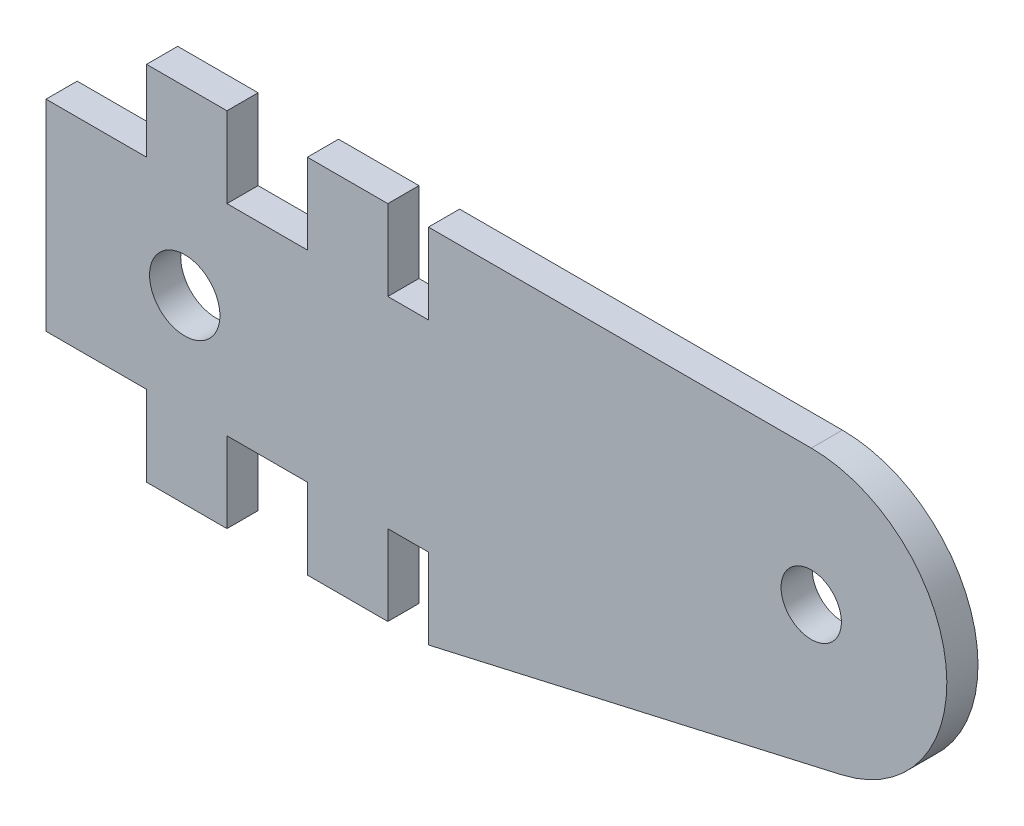
from build123d import *

# Parameters (mm, degrees)
SKETCH1_R           = 1.75
SKETCH1_R_2         = 1.5
BOSS_EXTRUDE1_DEPTH = 1.55


with BuildPart() as part:
    # Sketch1 → Boss-Extrude1 (new body)
    with BuildSketch(Plane.XY):
        with BuildLine():
            Line((5, 0), (9, 0))
            Line((9, 0), (9, 4))
            Line((9, 4), (13, 4))
            Line((13, 4), (13, 0))
            Line((13, 0), (17, 0))
            Line((17, 0), (17, 4))
            Line((17, 4), (19.021561934, 4))
            Line((19.021561934, 4), (19.021561934, 0))
            Line((19.021561934, 0), (39.557599026, 4.677766061))
            ThreePointArc((39.557599026, 4.677766061), (44.762590659, 12.008417985), (38.059495851, 17.999988357))
            Line((38.059495851, 17.999988357), (19.021561934, 17.999988357))
            Line((19.021561934, 17.999988357), (19.021561934, 13.999988357))
            Line((19.021561934, 13.999988357), (17, 13.999988357))
            Line((17, 13.999988357), (17, 17.999988357))
            Line((17, 17.999988357), (13, 17.999988357))
            Line((13, 17.999988357), (13, 13.999988357))
            Line((13, 13.999988357), (9, 13.999988357))
            Line((9, 13.999988357), (9, 17.999988357))
            Line((9, 17.999988357), (5, 17.999988357))
            Line((5, 17.999988357), (5, 13.999988357))
            Line((5, 13.999988357), (0, 13.999988357))
            Line((0, 13.999988357), (0, 4))
            Line((0, 4), (5, 4))
            Line((5, 4), (5, 0))
        make_face()
        with Locations(Location((6.9, 9, 0), (0, 0, 180))):
            Circle(SKETCH1_R, mode=Mode.SUBTRACT)
        with Locations(Location((38.059495851, 11.254645274, 0), (0, 0, 180))):
            Circle(SKETCH1_R_2, mode=Mode.SUBTRACT)
    extrude(amount=BOSS_EXTRUDE1_DEPTH)


solid = part.part
